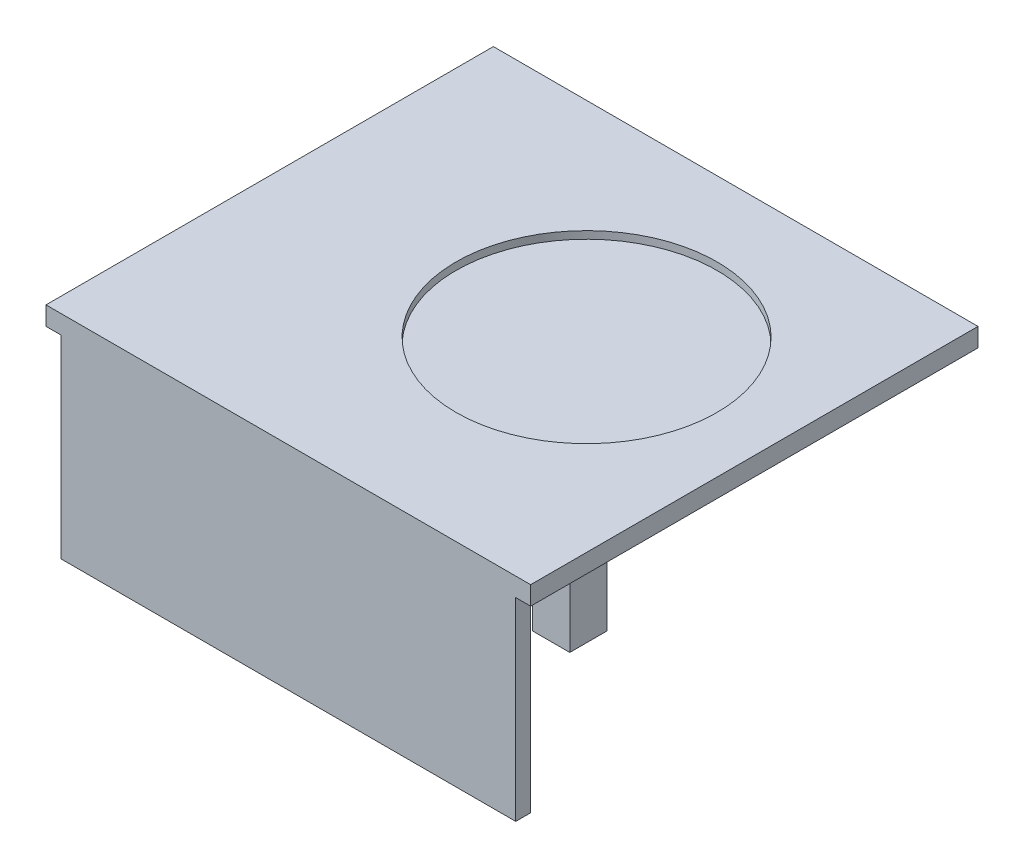
from build123d import *

# Parameters (mm, degrees)
SKETCH2_W           = 130
SKETCH2_H           = 120
BOSS_EXTRUDE1_DEPTH = 5
SKETCH3_W           = 126
SKETCH3_H           = 4
BOSS_EXTRUDE2_DEPTH = 52
SKETCH5_R           = 35
CUT_EXTRUDE1_DEPTH  = 2
SKETCH7_W           = 10
SKETCH7_H           = 10
BOSS_EXTRUDE3_DEPTH = 20
SKETCH9_W           = 4
SKETCH9_H           = 52
CUT_EXTRUDE2_DEPTH  = 5


with BuildPart() as part:
    # Sketch2 → Boss-Extrude1 (new body)
    with BuildSketch(Plane(origin=(0, 0, 0), x_dir=(1, 0, 0), z_dir=(0, 1, 0))):
        Rectangle(SKETCH2_W, SKETCH2_H)
    extrude(amount=BOSS_EXTRUDE1_DEPTH)

    # Sketch3 → Boss-Extrude2 (add)
    with BuildSketch(Plane.XZ):
        with Locations((-2, 58)):
            Rectangle(SKETCH3_W, SKETCH3_H)
    extrude(amount=BOSS_EXTRUDE2_DEPTH)

    # Sketch5 → Cut-Extrude1 (cut)
    with BuildSketch(Plane(origin=(0, 5, 0), x_dir=(1, 0, 0), z_dir=(0, 1, 0))):
        with Locations(Location((15, 5, 0), (0, 0, 270))):
            Circle(SKETCH5_R)
    extrude(amount=-CUT_EXTRUDE1_DEPTH, mode=Mode.SUBTRACT)

    # Sketch7 → Boss-Extrude3 (add)
    with BuildSketch(Plane.XZ):
        with Locations((-56, 40.5)):
            Rectangle(SKETCH7_W, SKETCH7_H)
        with Locations((56, 40.5)):
            Rectangle(SKETCH7_W, SKETCH7_H)
    extrude(amount=BOSS_EXTRUDE3_DEPTH)

    # Sketch9 → Cut-Extrude2 (cut)
    with BuildSketch(Plane(origin=(0, 0, 56), x_dir=(-1, 0, 0), z_dir=(0, 0, -1))):
        with Locations((63, -26)):
            Rectangle(SKETCH9_W, SKETCH9_H)
    extrude(amount=-CUT_EXTRUDE2_DEPTH, mode=Mode.SUBTRACT)


solid = part.part
